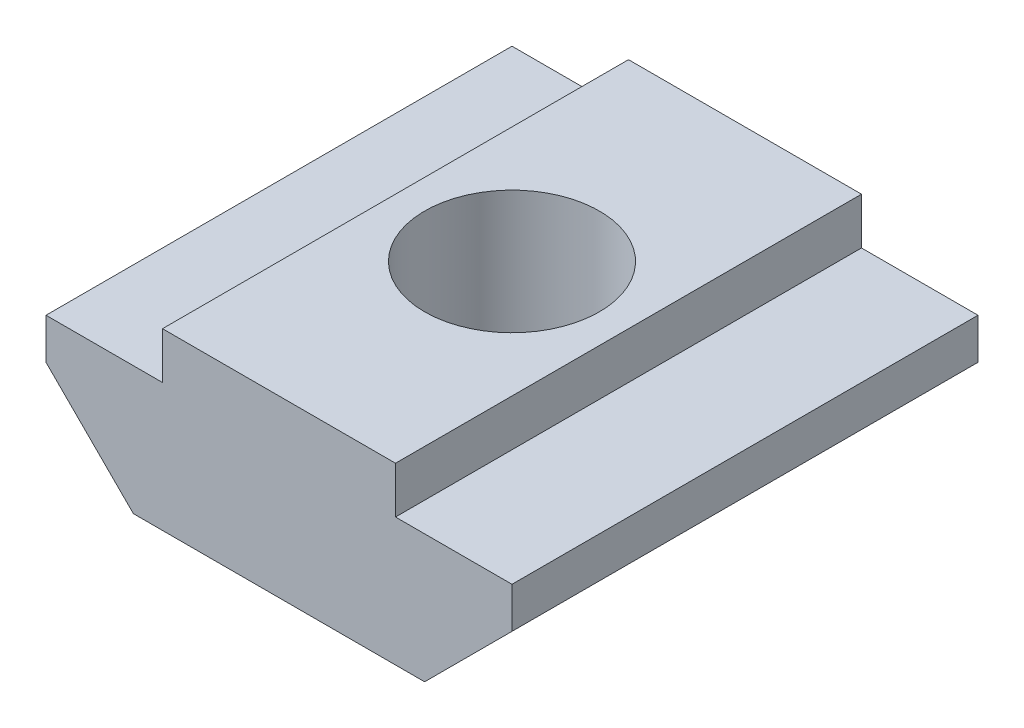
from build123d import *

# Parameters (mm, degrees)
EXTRUDE_1_DEPTH          = 16
CUT_EXTRUDE_1_DEPTH      = 19.421726303
CUT_EXTRUDE_1_DEPTH_BACK = 19.421726303
SKETCH_2_R               = 3


with BuildPart() as part:
    # 草图1 → 凸台-拉伸1 (new body)
    with BuildSketch(Plane.XY):
        Polygon((5, -4.4), (-5, -4.4), (-8, -1.4), (-8, 0), (-4, 0), (-4, 1.6), (4, 1.6), (4, 0), (8, 0), (8, -1.4), align=None)
    extrude(amount=EXTRUDE_1_DEPTH)

    # 草图2 → 切除-拉伸1 (cut, two sides: drawn at the far end of the back side and taken through both)
    with BuildSketch(Plane(origin=(0, 0, 0), x_dir=(1, 0, 0), z_dir=(0, 1, 0)).offset(-CUT_EXTRUDE_1_DEPTH_BACK)):
        with Locations(Location((0, -8, 0), (0, 0, 270))):
            Circle(SKETCH_2_R)
    extrude(amount=CUT_EXTRUDE_1_DEPTH + CUT_EXTRUDE_1_DEPTH_BACK, mode=Mode.SUBTRACT)


solid = part.part
